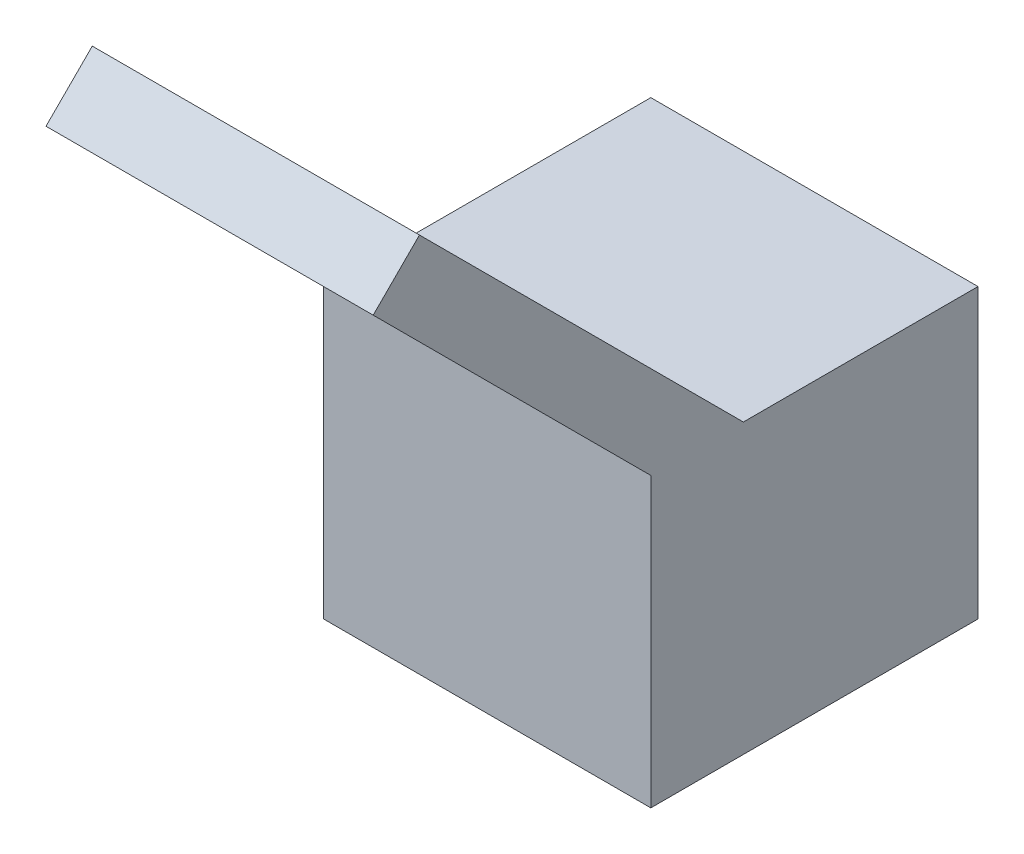
from build123d import *

# Parameters (mm, degrees)
SKETCH1_W           = 25
SKETCH1_H           = 25
SKETCH1_W_2         = 21
SKETCH1_H_2         = 21
BOSS_EXTRUDE1_DEPTH = 2
BOSS_EXTRUDE2_START = -2
SKETCH1_3_W         = 25
SKETCH1_3_H         = 25
SKETCH1_3_W_2       = 21
SKETCH1_3_H_2       = 21
BOSS_EXTRUDE2_DEPTH = 20
CUT_EXTRUDE1_REACH  = 37.57
SKETCH2_R           = 1.75
BOSS_EXTRUDE3_START = 12.5
BOSS_EXTRUDE3_DEPTH = 25
SKETCH4_R           = 3.3782
CUT_EXTRUDE2_DEPTH  = 44.259672441


with BuildPart() as part:
    # Sketch1 → Boss-Extrude1 (new body)
    # profile 1 of 2: a face of its own
    with BuildSketch(Plane(origin=(0, 0, 0), x_dir=(1, 0, 0), z_dir=(0, 1, 0))):
        Rectangle(SKETCH1_W, SKETCH1_H)
        Rectangle(SKETCH1_W_2, SKETCH1_H_2, mode=Mode.SUBTRACT)
    # profile 2 of 2: a face of its own
    with BuildSketch(Plane(origin=(0, 0, 0), x_dir=(1, 0, 0), z_dir=(0, 1, 0))):
        Rectangle(SKETCH1_W_2, SKETCH1_H_2)
    extrude(amount=-BOSS_EXTRUDE1_DEPTH)

    # Sketch1<3> → Boss-Extrude2 (add)
    with BuildSketch(Plane(origin=(0, 0, 0), x_dir=(1, 0, 0), z_dir=(0, 1, 0)).offset(BOSS_EXTRUDE2_START)):
        Rectangle(SKETCH1_3_W, SKETCH1_3_H)
        Rectangle(SKETCH1_3_W_2, SKETCH1_3_H_2, mode=Mode.SUBTRACT)
    extrude(amount=-BOSS_EXTRUDE2_DEPTH)

    # Sketch2 → Cut-Extrude1 (cut, up to next)
    with BuildSketch(Plane.XY.offset(-12.5), mode=Mode.PRIVATE) as cut_extrude1_sk1:
        with Locations(Location((0, -11, 0), (0, 0, 180))):
            Circle(SKETCH2_R)
    cut_extrude1_tool1 = extrude(cut_extrude1_sk1.sketch, amount=CUT_EXTRUDE1_REACH, mode=Mode.PRIVATE) & part.part
    add(cut_extrude1_tool1.solids().sort_by_distance((0, -11, -12.5))[0], mode=Mode.SUBTRACT)

    # Sketch3 → Boss-Extrude3 (add, through all)
    with BuildSketch(Plane(origin=(0, 0, 0), x_dir=(0, 0, -1), z_dir=(1, 0, 0)).offset(BOSS_EXTRUDE3_START)):
        Polygon((-12.5, 0), (-33.713203436, 21.213203436), (-30.17766953, 24.748737342), (-5.428932188, 0), align=None)
    extrude(amount=-BOSS_EXTRUDE3_DEPTH)

    # Sketch4 → Cut-Extrude2 (cut, through all)
    with BuildSketch(Plane(origin=(0, -6.25, 6.25), x_dir=(1, 0, 0), z_dir=(0, -0.7071067811865467, 0.7071067811865485))):
        with Locations(Location((0, 23.838834765, 0), (0, 0, 270))):
            Circle(SKETCH4_R)
    extrude(amount=-CUT_EXTRUDE2_DEPTH, mode=Mode.SUBTRACT)


solid = part.part
